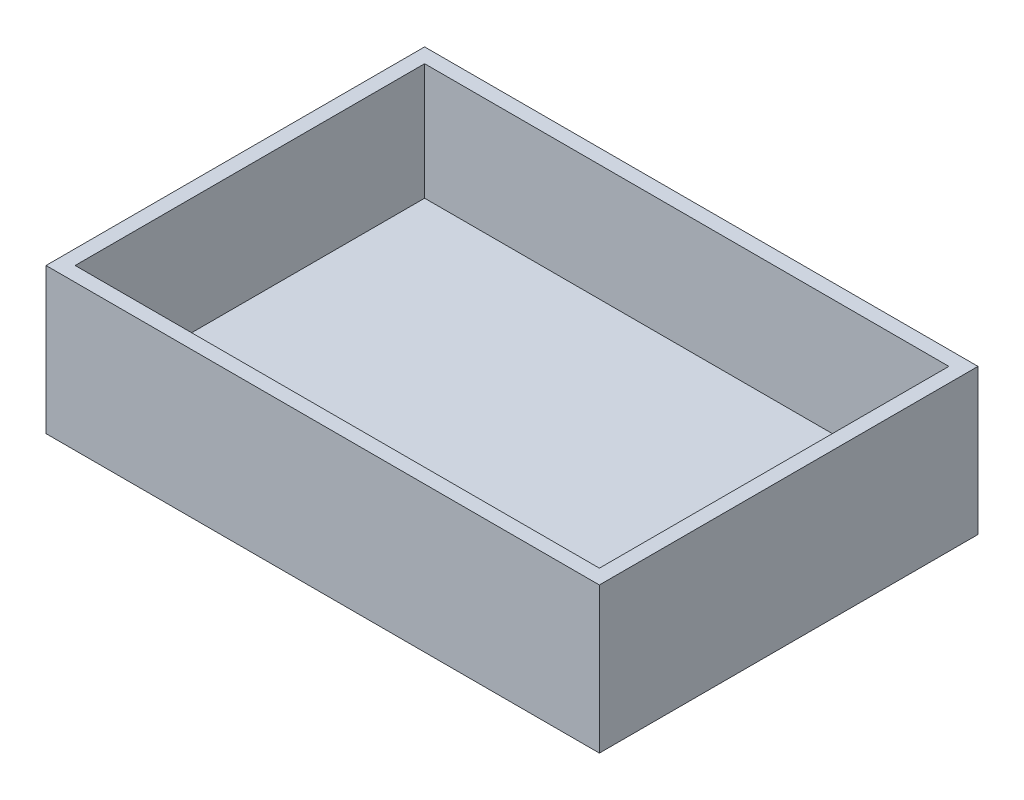
from build123d import *

# Parameters (mm, degrees)
SKETCH1_W           = 190
SKETCH1_H           = 130
BOSS_EXTRUDE1_DEPTH = 10
SKETCH1_7_W         = 190
SKETCH1_7_H         = 130
SKETCH1_7_W_2       = 180
SKETCH1_7_H_2       = 120
BOSS_EXTRUDE2_DEPTH = 50


with BuildPart() as part:
    # Sketch1 → Boss-Extrude1 (new body)
    with BuildSketch(Plane(origin=(0, 0, 0), x_dir=(1, 0, 0), z_dir=(0, 1, 0))):
        with Locations((-80, 50)):
            Rectangle(SKETCH1_W, SKETCH1_H)
    extrude(amount=BOSS_EXTRUDE1_DEPTH)

    # Sketch1<7> → Boss-Extrude2 (add)
    with BuildSketch(Plane(origin=(0, 0, 0), x_dir=(1, 0, 0), z_dir=(0, 1, 0))):
        with Locations((-80, 50)):
            Rectangle(SKETCH1_7_W, SKETCH1_7_H)
        with Locations((-80, 50)):
            Rectangle(SKETCH1_7_W_2, SKETCH1_7_H_2, mode=Mode.SUBTRACT)
    extrude(amount=BOSS_EXTRUDE2_DEPTH)


solid = part.part
